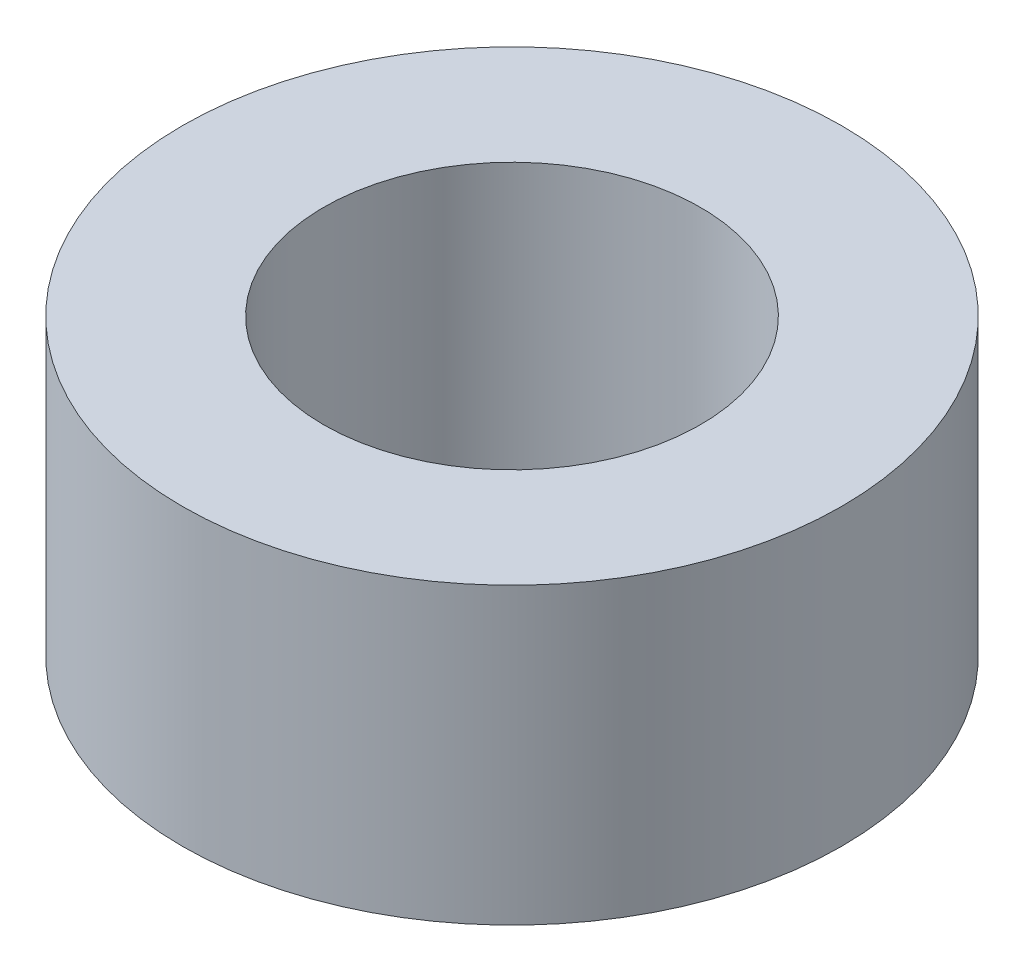
from build123d import *

# Parameters (mm, degrees)
SKETCH1_R           = 28
SKETCH1_R_2         = 16
BOSS_EXTRUDE1_DEPTH = 25


with BuildPart() as part:
    # Sketch1 → Boss-Extrude1 (new body)
    with BuildSketch(Plane(origin=(0, 0, 0), x_dir=(1, 0, 0), z_dir=(0, 1, 0))):
        with Locations(Location((0, 0, 0), (0, 0, 270))):
            Circle(SKETCH1_R)
        with Locations(Location((0, 0, 0), (0, 0, 270))):
            Circle(SKETCH1_R_2, mode=Mode.SUBTRACT)
    extrude(amount=BOSS_EXTRUDE1_DEPTH)


solid = part.part
